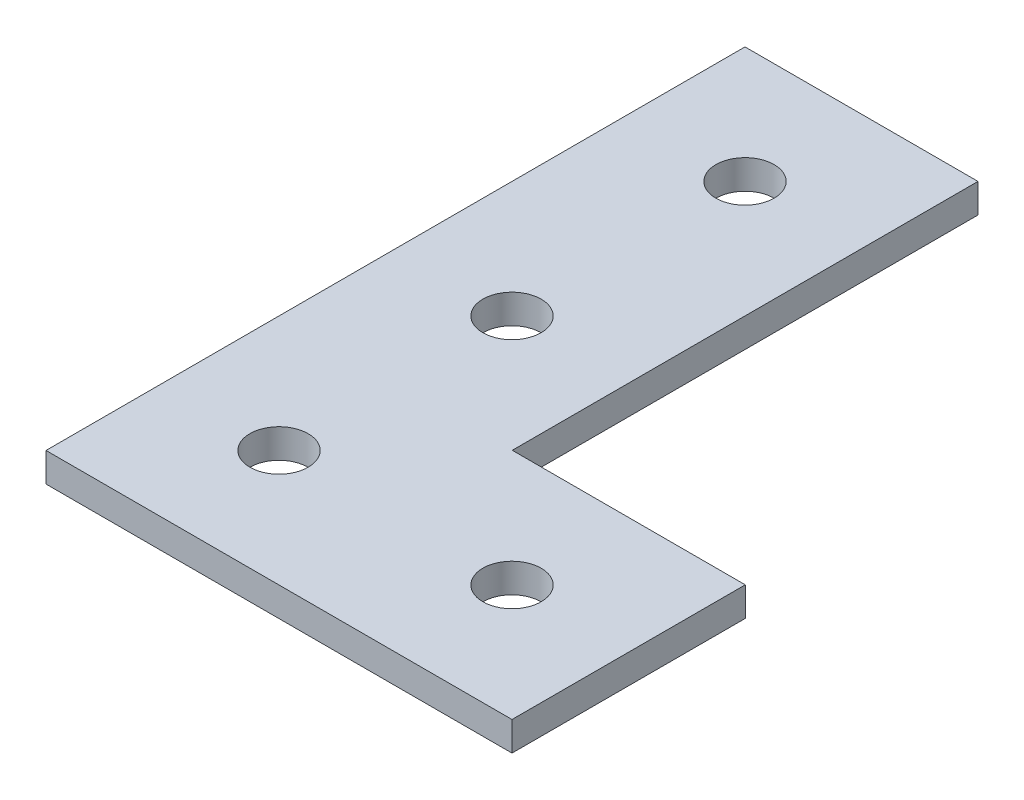
from build123d import *

# Parameters (mm, degrees)
BOSS_EXTRUDE1_DEPTH = 3.175
SKETCH2_R           = 3.175
CUT_EXTRUDE1_DEPTH  = 3.175
LPATTERN1_COUNT     = 3
LPATTERN1_PITCH     = 25.4
LPATTERN2_COUNT     = 2
LPATTERN2_PITCH     = 25.4


with BuildPart() as part:
    # Sketch1 → Boss-Extrude1 (new body)
    with BuildSketch(Plane(origin=(0, 0, 0), x_dir=(1, 0, 0), z_dir=(0, 1, 0))):
        Polygon((0, 0), (0, 76.2), (25.4, 76.2), (25.4, 25.429586946), (50.8, 25.429586946), (50.8, 0), align=None)
    extrude(amount=BOSS_EXTRUDE1_DEPTH)

    # Sketch2 → Cut-Extrude1 (cut)
    with BuildSketch(Plane(origin=(0, 3.175, 0), x_dir=(1, 0, 0), z_dir=(0, 1, 0))):
        with Locations(Location((12.7, 12.7, 0), (0, 0, 270))):
            Circle(SKETCH2_R)
    cut_extrude1 = extrude(amount=-CUT_EXTRUDE1_DEPTH, mode=Mode.SUBTRACT)

    # LPattern1: Cut-Extrude1 ×3
    with Locations(*[(0, 0, -i * LPATTERN1_PITCH) for i in range(1, LPATTERN1_COUNT)]):
        add(cut_extrude1, mode=Mode.SUBTRACT)

    # LPattern2: Cut-Extrude1 ×2
    with Locations(*[(i * LPATTERN2_PITCH, 0, 0) for i in range(1, LPATTERN2_COUNT)]):
        add(cut_extrude1, mode=Mode.SUBTRACT)


solid = part.part
